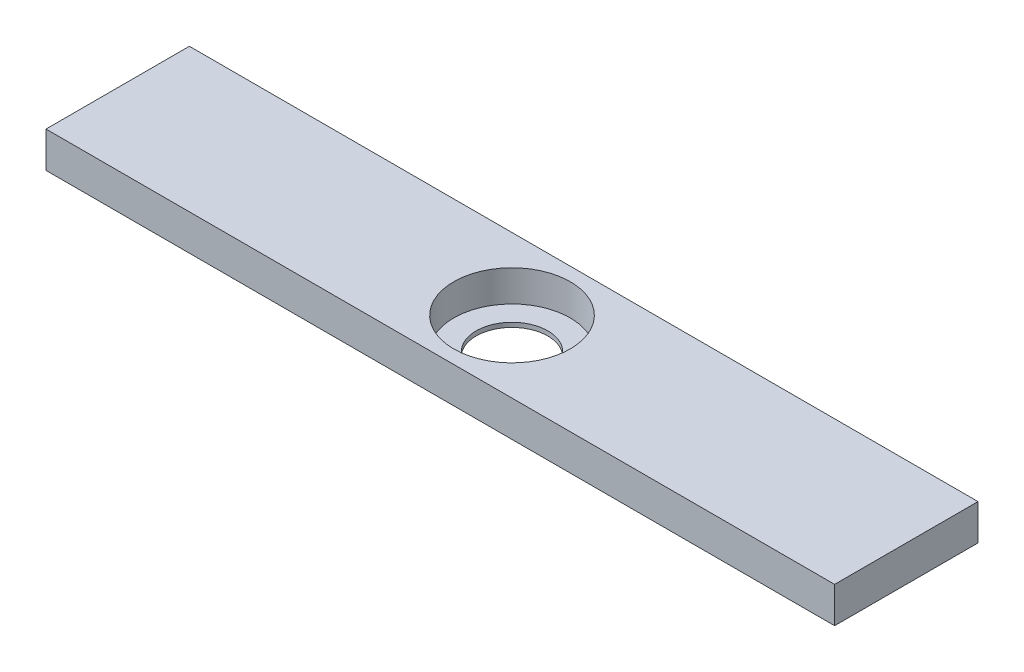
from build123d import *

# Parameters (mm, degrees)
SKETCH1_W           = 279.4
SKETCH1_H           = 50.8
BOSS_EXTRUDE1_DEPTH = 12.7
SKETCH2_R           = 20.6375
CUT_EXTRUDE1_DEPTH  = 11.1125
SKETCH3_R           = 12.7
CUT_EXTRUDE2_DEPTH  = 143.42449809


with BuildPart() as part:
    # Sketch1 → Boss-Extrude1 (new body)
    with BuildSketch(Plane(origin=(0, 0, 0), x_dir=(1, 0, 0), z_dir=(0, 1, 0))):
        Rectangle(SKETCH1_W, SKETCH1_H)
    extrude(amount=BOSS_EXTRUDE1_DEPTH)

    # Sketch2 → Cut-Extrude1 (cut)
    with BuildSketch(Plane(origin=(0, 12.7, 0), x_dir=(1, 0, 0), z_dir=(0, 1, 0))):
        with Locations(Location((0, 0, 0), (0, 0, 270))):
            Circle(SKETCH2_R)
    extrude(amount=-CUT_EXTRUDE1_DEPTH, mode=Mode.SUBTRACT)

    # Sketch3 → Cut-Extrude2 (cut, through all)
    with BuildSketch(Plane(origin=(0, 1.5875, 0), x_dir=(1, 0, 0), z_dir=(0, 1, 0))):
        with Locations(Location((0, 0, 0), (0, 0, 270))):
            Circle(SKETCH3_R)
    extrude(amount=-CUT_EXTRUDE2_DEPTH, mode=Mode.SUBTRACT)


solid = part.part
